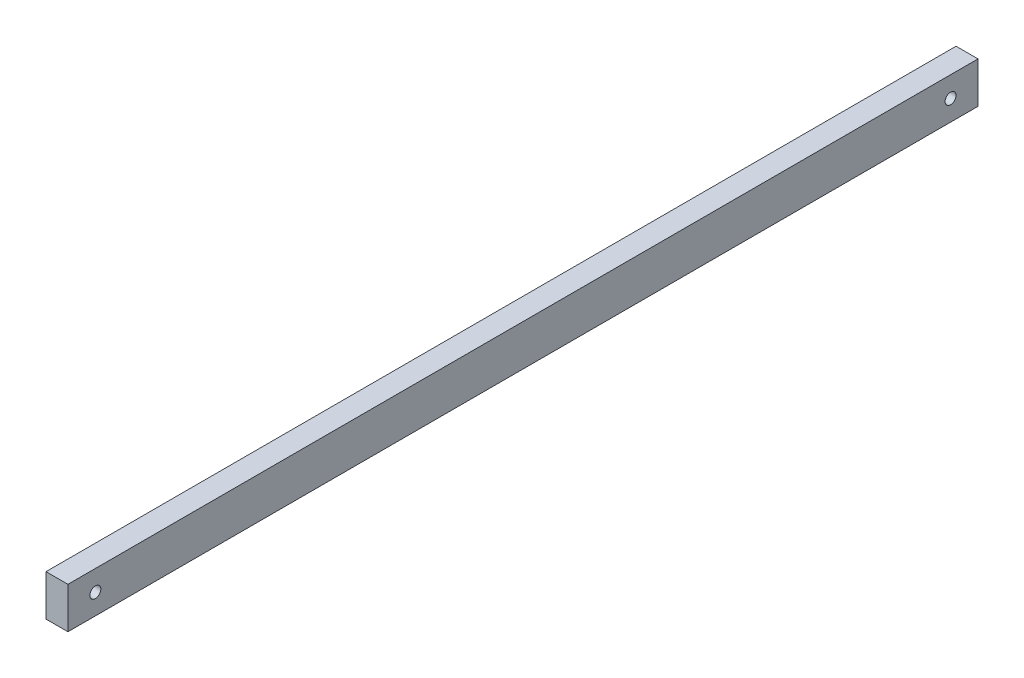
from build123d import *

# Parameters (mm, degrees)
SKETCH1_W           = 8
SKETCH1_H           = 15
BOSS_EXTRUDE1_DEPTH = 332
CUT_EXTRUDE1_REACH  = 334.181
SKETCH2_R           = 2


with BuildPart() as part:
    # Sketch1 → Boss-Extrude1 (new body)
    with BuildSketch(Plane.XY):
        Rectangle(SKETCH1_W, SKETCH1_H)
    extrude(amount=BOSS_EXTRUDE1_DEPTH)

    # Sketch2 → Cut-Extrude1 (cut, up to next)
    with BuildSketch(Plane.ZY.offset(4), mode=Mode.PRIVATE) as cut_extrude1_sk1:
        with Locations((10, 0)):
            Circle(SKETCH2_R)
    cut_extrude1_tool1 = extrude(cut_extrude1_sk1.sketch, amount=-CUT_EXTRUDE1_REACH, mode=Mode.PRIVATE) & part.part
    # Sketch2 → Cut-Extrude1 (cut, up to next)
    with BuildSketch(Plane.ZY.offset(4), mode=Mode.PRIVATE) as cut_extrude1_sk2:
        with Locations((322, 0)):
            Circle(SKETCH2_R)
    cut_extrude1_tool2 = extrude(cut_extrude1_sk2.sketch, amount=-CUT_EXTRUDE1_REACH, mode=Mode.PRIVATE) & part.part
    add(cut_extrude1_tool1.solids().sort_by_distance((-4, 0, 10))[0], mode=Mode.SUBTRACT)
    add(cut_extrude1_tool2.solids().sort_by_distance((-4, 0, 322))[0], mode=Mode.SUBTRACT)


solid = part.part
